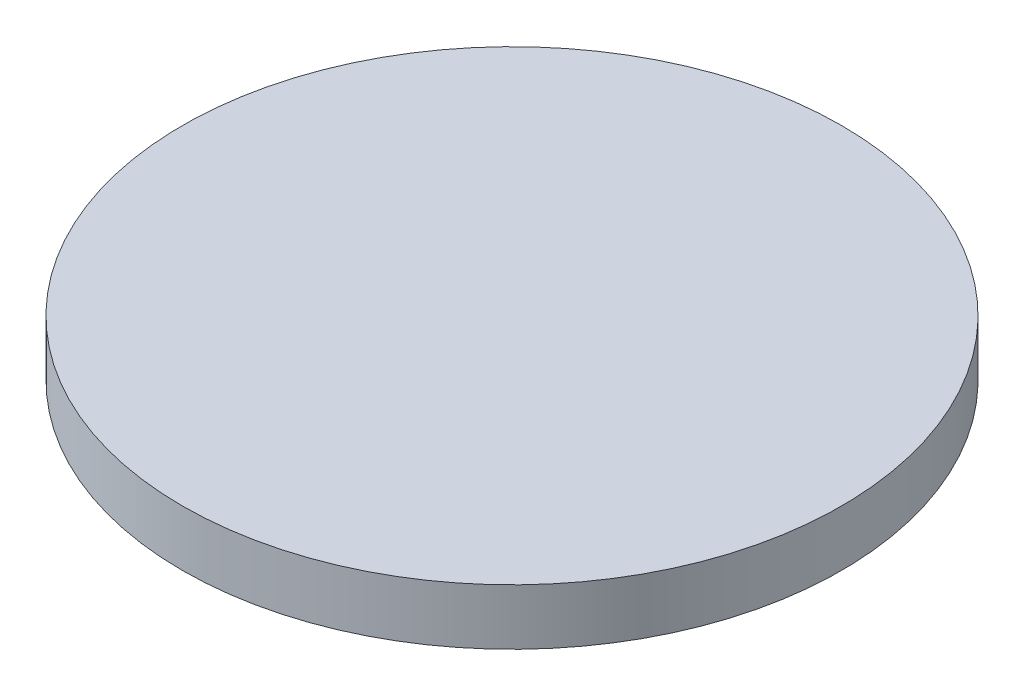
from build123d import *

# Parameters (mm, degrees)
SKETCH1_R           = 37.465
BOSS_EXTRUDE1_DEPTH = 6.35


with BuildPart() as part:
    # Sketch1 → Boss-Extrude1 (new body)
    with BuildSketch(Plane(origin=(0, 0, 0), x_dir=(1, 0, 0), z_dir=(0, 1, 0))):
        with Locations(Location((0, 0, 0), (0, 0, 270))):
            Circle(SKETCH1_R)
    extrude(amount=BOSS_EXTRUDE1_DEPTH)


solid = part.part
